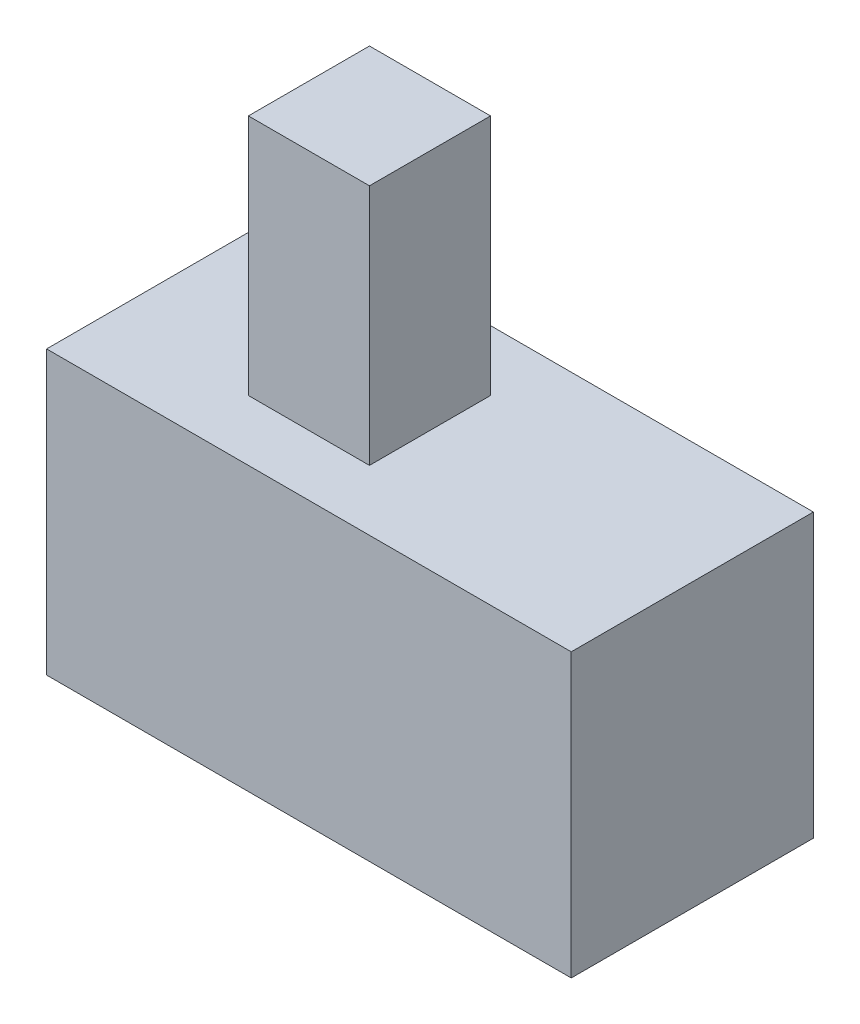
from build123d import *

# Parameters (mm, degrees)
SKETCH1_W           = 13
SKETCH1_H           = 7
BOSS_EXTRUDE1_DEPTH = 6
SKETCH2_W           = 3
SKETCH2_H           = 3
BOSS_EXTRUDE2_DEPTH = 6


with BuildPart() as part:
    # Sketch1 → Boss-Extrude1 (new body)
    with BuildSketch(Plane.XY):
        Rectangle(SKETCH1_W, SKETCH1_H)
    extrude(amount=BOSS_EXTRUDE1_DEPTH)

    # Sketch2 → Boss-Extrude2 (add)
    with BuildSketch(Plane(origin=(0, 3.5, 0), x_dir=(1, 0, 0), z_dir=(0, 1, 0))):
        with Locations((-1.5, -3)):
            Rectangle(SKETCH2_W, SKETCH2_H)
    extrude(amount=BOSS_EXTRUDE2_DEPTH)


solid = part.part
